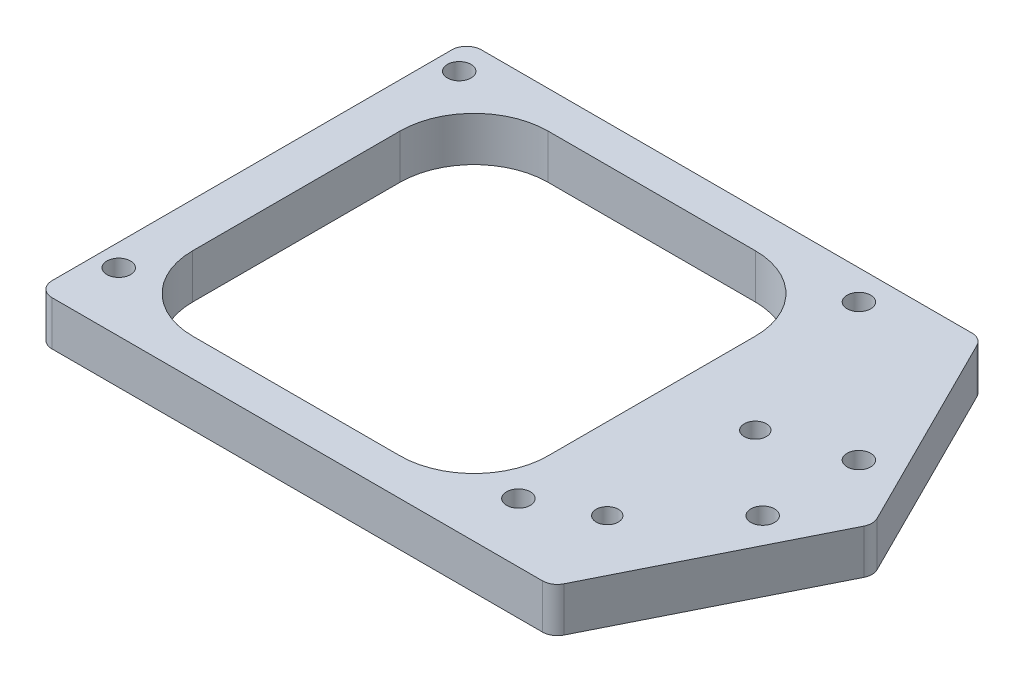
from build123d import *

# Parameters (mm, degrees)
BOSS_EXTRUDE1_DEPTH     = 1.5
CUT_EXTRUDE1_DEPTH      = 52.061237744
CUT_EXTRUDE1_DEPTH_BACK = 52.061237744
SKETCH2_W               = 24
SKETCH2_H               = 24
FILLET1_R               = 5
M2X0_4_TAPPED_HOLE1_D   = 1.6
F_1_5MM_DOWEL_HOLE1_D   = 1.5
FILLET2_R               = 1


with BuildPart() as part:
    # Sketch1 → Boss-Extrude1 (new, symmetric)
    with BuildSketch(Plane(origin=(0, 0, 0), x_dir=(1, 0, 0), z_dir=(0, 1, 0))):
        Polygon((0, 0), (34.748434417, 0), (42, 14.5), (34.748434417, 29), (0, 29), align=None)
    extrude(amount=BOSS_EXTRUDE1_DEPTH, both=True)

    # Sketch2 → Cut-Extrude1 (cut, two sides: drawn at the far end of the back side and taken through both)
    with BuildSketch(Plane(origin=(0, 0, 0), x_dir=(1, 0, 0), z_dir=(0, 1, 0)).offset(-CUT_EXTRUDE1_DEPTH_BACK)):
        with Locations((15, 14.5)):
            Rectangle(SKETCH2_W, SKETCH2_H)
    extrude(amount=CUT_EXTRUDE1_DEPTH + CUT_EXTRUDE1_DEPTH_BACK, mode=Mode.SUBTRACT)

    # Fillet1
    fillet1_edges = [part.edges().sort_by_distance(p)[0] for p in [
        (3, 0, -2.5),
        (3, 0, -26.5),
        (27, 0, -26.5),
        (27, 0, -2.5),
    ]]
    fillet(fillet1_edges, radius=FILLET1_R)

    # M2x0.4 Tapped Hole1 (through all)
    with Locations(Plane(origin=(1.5, 1.5, -27), x_dir=(0, 0, 1), z_dir=(0, 1, 0))):
        with Locations((0, 0), (0, 27), (9.25, 36.248434417), (15.75, 36.248434417), (23, 27), (23, 0)):
            Hole(M2X0_4_TAPPED_HOLE1_D / 2)

    # Ø1.5mm Dowel Hole1 (through all)
    with Locations(Plane(origin=(32.5, 1.5, -16), x_dir=(0, 0, 1), z_dir=(0, 1, 0))):
        with Locations((0, 0), (10, 0)):
            Hole(F_1_5MM_DOWEL_HOLE1_D / 2)

    # Fillet2
    fillet2_edges = [part.edges().sort_by_distance(p)[0] for p in [
        (0, 0, -29),
        (34.748434417, 0, -29),
        (42, 0, -14.5),
        (34.748434417, 0, 0),
        (0, 0, 0),
    ]]
    fillet(fillet2_edges, radius=FILLET2_R)


solid = part.part
